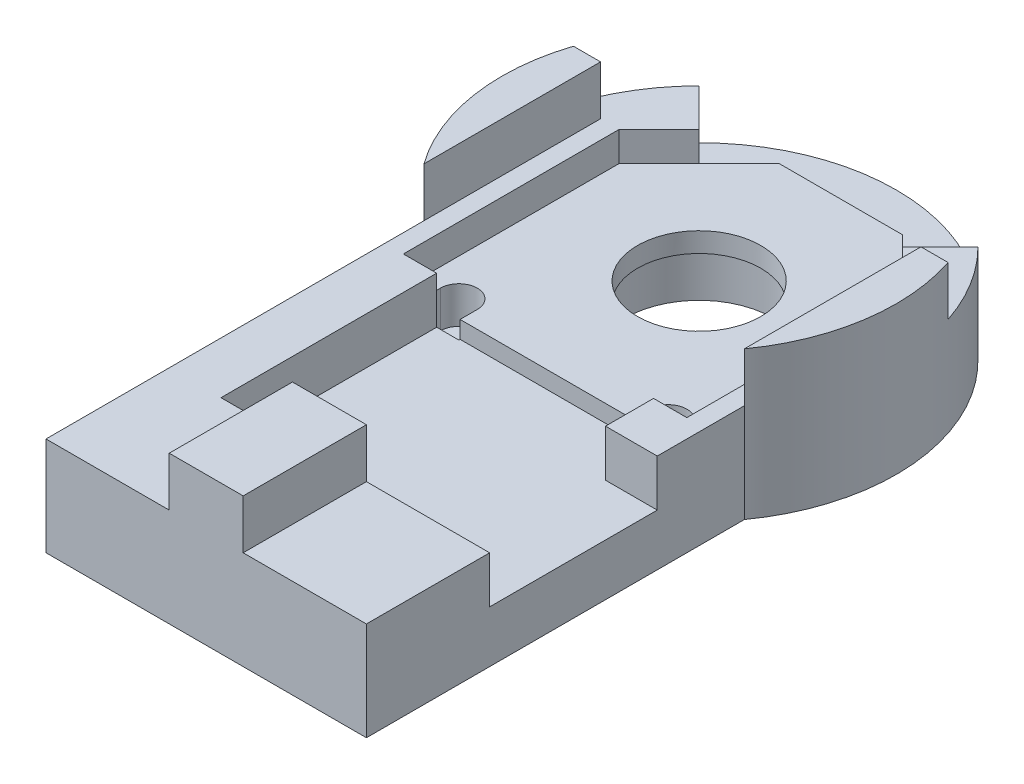
from build123d import *
from build123d.topology import SkipClean

# Parameters (mm, degrees)
BOSS_EXTRUDE1_DEPTH = 4
SKETCH2_R           = 3
CUT_EXTRUDE1_DEPTH  = 2
SKETCH3_R           = 1.5
CUT_EXTRUDE2_DEPTH  = 22.633307653
CUT_EXTRUDE4_START  = -1.2
CUT_EXTRUDE4_DEPTH  = 1.2
CUT_EXTRUDE6_DEPTH  = 1.5
CUT_EXTRUDE7_DEPTH  = 0.7
BOSS_EXTRUDE3_DEPTH = 2
CUT_EXTRUDE12_START = -2
CUT_EXTRUDE12_DEPTH = 2
SKETCH6_R           = 2.5
CUT_EXTRUDE13_DEPTH = 22.777052142
SKETCH16_W          = 3
SKETCH16_H          = 5
BOSS_EXTRUDE4_DEPTH = 2
BOSS_EXTRUDE6_DEPTH = 1.9


with BuildPart() as part:
    # Sketch1 → Boss-Extrude1 (new body)
    with BuildSketch(Plane(origin=(0, 0, 0), x_dir=(1, 0, 0), z_dir=(0, 1, 0))):
        with BuildLine():
            Line((6.5, -20), (6.5, -4.663689527))
            ThreePointArc((6.5, -4.663689527), (7.615773106, -2.449489743), (8, 0))
            ThreePointArc((8, 0), (7.615773106, 2.449489743), (6.5, 4.663689527))
            ThreePointArc((6.5, 4.663689527), (0, 8), (-6.5, 4.663689527))
            ThreePointArc((-6.5, 4.663689527), (-7.615773106, 2.449489743), (-8, 0))
            ThreePointArc((-8, 0), (-7.615773106, -2.449489743), (-6.5, -4.663689527))
            Line((-6.5, -4.663689527), (-6.5, -20))
            Line((-6.5, -20), (6.5, -20))
        make_face()
    extrude(amount=BOSS_EXTRUDE1_DEPTH)

    # Sketch2 → Cut-Extrude1 (cut)
    with BuildSketch(Plane.XZ):
        with Locations(Location((0, 0, 0), (0, 0, 270))):
            Circle(SKETCH2_R)
    extrude(amount=-CUT_EXTRUDE1_DEPTH, mode=Mode.SUBTRACT)

    # Sketch3 → Cut-Extrude2 (cut, through all)
    with BuildSketch(Plane.XZ.offset(-2)):
        with Locations(Location((0, 0, 0), (0, 0, 270))):
            Circle(SKETCH3_R)
    extrude(amount=-CUT_EXTRUDE2_DEPTH, mode=Mode.SUBTRACT)

    # Sketch5 → Cut-Extrude4 (cut)
    with BuildSketch(Plane(origin=(0, 4, 0), x_dir=(1, 0, 0), z_dir=(0, 1, 0)).offset(CUT_EXTRUDE4_START)):
        with BuildLine():
            Line((5.75, 2.5), (2.5, 5.75))
            Line((2.5, 5.75), (0.75, 5.75))
            Line((0.75, 5.75), (0.75, 7.964766161))
            ThreePointArc((0.75, 7.964766161), (0, 8), (-0.75, 7.964766161))
            Line((-0.75, 7.964766161), (-0.75, 5.75))
            Line((-0.75, 5.75), (-2.5, 5.75))
            Line((-2.5, 5.75), (-5.75, 2.5))
            Line((-5.75, 2.5), (-5.75, -6.25))
            Line((-5.75, -6.25), (-4.4, -6.25))
            Line((-4.4, -6.25), (-4.4, -8.2))
            Line((-4.4, -8.2), (-5.66, -10))
            Line((-5.66, -10), (-6.5, -10))
            Line((-6.5, -10), (-6.5, -11.2))
            Line((-6.5, -11.2), (-6.5, -15))
            Line((-6.5, -15), (6.5, -15))
            Line((6.5, -15), (6.5, -11.2))
            Line((6.5, -11.2), (6.5, -10))
            Line((6.5, -10), (6.5, -8.2))
            Line((6.5, -8.2), (4.4, -8.2))
            Line((4.4, -8.2), (4.4, -6.25))
            Line((4.4, -6.25), (5.75, -6.25))
            Line((5.75, -6.25), (5.75, 2.5))
        make_face()
    extrude(amount=CUT_EXTRUDE4_DEPTH, mode=Mode.SUBTRACT)

    # Sketch7 → Cut-Extrude6 (cut)
    with BuildSketch(Plane(origin=(0, 2.8, 0), x_dir=(1, 0, 0), z_dir=(0, 1, 0))):
        with BuildLine():
            Line((-4.999999999, -5.5), (-4.999999999, -6.25))
            Line((-4.999999999, -6.25), (-3.499999999, -6.25))
            Line((-3.499999999, -6.25), (-3.499999999, -5.5))
            ThreePointArc((-3.499999999, -5.5), (-4.249999999, -4.75), (-4.999999999, -5.5))
        make_face()
        with BuildLine():
            Line((3.500000001, -5.5), (3.500000001, -6.25))
            Line((3.500000001, -6.25), (5.000000001, -6.25))
            Line((5.000000001, -6.25), (5.000000001, -5.5))
            ThreePointArc((5.000000001, -5.5), (4.250000001, -4.75), (3.500000001, -5.5))
        make_face()
    extrude(amount=-CUT_EXTRUDE6_DEPTH, mode=Mode.SUBTRACT)

    # Sketch9 → Cut-Extrude7 (cut)
    with BuildSketch(Plane(origin=(0, 2.8, 0), x_dir=(1, 0, 0), z_dir=(0, 1, 0))):
        Polygon((-6.5, -15), (6.5, -15), (6.5, -8.2), (4.4, -8.2), (4.4, -6.2), (-4.4, -6.2), (-4.4, -8.2), (-5.66, -10), (-6.5, -10), align=None)
    extrude(amount=-CUT_EXTRUDE7_DEPTH, mode=Mode.SUBTRACT)

    # Sketch14 → Boss-Extrude3 (add)
    with SkipClean():  # the faces are left unmerged after this step: merging them gives an invalid solid
        with BuildSketch(Plane(origin=(0, 4, 0), x_dir=(1, 0, 0), z_dir=(0, 1, 0))):
            with BuildLine():
                Line((6.5, -4.663689527), (6.5, 2.5))
                Line((6.5, 2.5), (7.599342077, 2.5))
                ThreePointArc((7.599342077, 2.5), (7.907431546, -1.213476964), (6.5, -4.663689527))
            make_face()
            with BuildLine():
                Line((-6.5, -4.663689527), (-6.5, 2.5))
                Line((-6.5, 2.5), (-7.599342077, 2.5))
                ThreePointArc((-7.599342077, 2.5), (-7.907431546, -1.213476964), (-6.5, -4.663689527))
            make_face()
        extrude(amount=BOSS_EXTRUDE3_DEPTH)

    # Sketch15 → Cut-Extrude12 (cut)
    with SkipClean():  # the faces are left unmerged after this step: merging them gives an invalid solid
        with BuildSketch(Plane(origin=(0, 4, 0), x_dir=(1, 0, 0), z_dir=(0, 1, 0)).offset(CUT_EXTRUDE12_START)):
            with BuildLine():
                Line((2.5, 5.75), (-2.5, 5.75))
                Line((-2.5, 5.75), (-4.125, 4.125))
                Line((-4.125, 4.125), (-5.656854249, 5.656854249))
                ThreePointArc((-5.656854249, 5.656854249), (0, 8), (5.656854249, 5.656854249))
                Line((5.656854249, 5.656854249), (4.125, 4.125))
                Line((4.125, 4.125), (2.5, 5.75))
            make_face()
        extrude(amount=CUT_EXTRUDE12_DEPTH, mode=Mode.SUBTRACT)

    # Sketch6 → Cut-Extrude13 (cut, through all)
    with SkipClean():  # the faces are left unmerged after this step: merging them gives an invalid solid
        with BuildSketch(Plane(origin=(0, 2.8, 0), x_dir=(1, 0, 0), z_dir=(0, 1, 0))):
            with Locations(Location((0, 0, 0), (0, 0, 270))):
                Circle(SKETCH6_R)
        extrude(amount=-CUT_EXTRUDE13_DEPTH, mode=Mode.SUBTRACT)

    # Sketch16 → Boss-Extrude4 (add)
    with SkipClean():  # the faces are left unmerged after this step: merging them gives an invalid solid
        with BuildSketch(Plane(origin=(0, 4, 0), x_dir=(1, 0, 0), z_dir=(0, 1, 0))):
            with Locations((0, -17.5)):
                Rectangle(SKETCH16_W, SKETCH16_H)
        extrude(amount=BOSS_EXTRUDE4_DEPTH)

    # Sketch18 → Boss-Extrude6 (add)
    with SkipClean():  # the faces are left unmerged after this step: merging them gives an invalid solid
        with BuildSketch(Plane(origin=(0, 2.1, 0), x_dir=(1, 0, 0), z_dir=(0, 1, 0))):
            Polygon((-4.4, -8.2), (-5.66, -10), (-6.5, -10), (-6.5, -15), (-4.4, -15), align=None)
        extrude(amount=BOSS_EXTRUDE6_DEPTH)


solid = part.part
